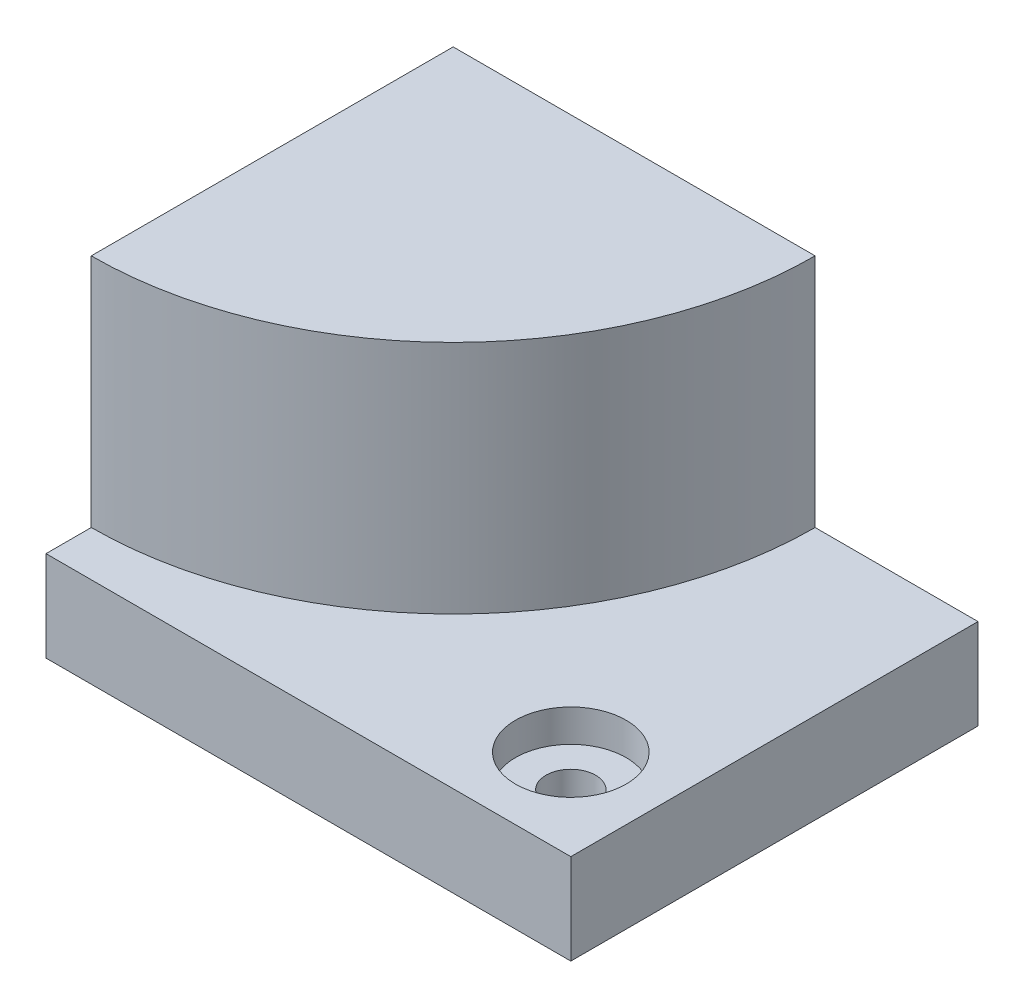
from build123d import *

# Parameters (mm, degrees)
SKETCH3_W                               = 58
SKETCH3_H                               = 45
BOSS_EXTRUDE1_DEPTH                     = 10
CBORE_FOR_M5_HEX_HEAD_BOLT1_D           = 5.5
CBORE_FOR_M5_HEX_HEAD_BOLT1_CBORE_D     = 12.24
CBORE_FOR_M5_HEX_HEAD_BOLT1_CBORE_DEPTH = 3.58
BOSS_EXTRUDE3_DEPTH                     = 16
BOSS_EXTRUDE4_DEPTH                     = 10
SKETCH10_R                              = 2
CUT_EXTRUDE2_DEPTH                      = 6


with BuildPart() as part:
    # Sketch3 → Boss-Extrude1 (new body)
    with BuildSketch(Plane(origin=(0, 0, 0), x_dir=(1, 0, 0), z_dir=(0, 1, 0))):
        Rectangle(SKETCH3_W, SKETCH3_H)
    extrude(amount=BOSS_EXTRUDE1_DEPTH)

    # CBORE for M5 Hex Head Bolt1 (through all)
    with Locations(Plane(origin=(0, 10, 0), x_dir=(1, 0, 0), z_dir=(0, 1, 0))):
        with Locations((19, -12.5)):
            CounterBoreHole(CBORE_FOR_M5_HEX_HEAD_BOLT1_D / 2, CBORE_FOR_M5_HEX_HEAD_BOLT1_CBORE_D / 2, CBORE_FOR_M5_HEX_HEAD_BOLT1_CBORE_DEPTH)

    # Sketch8 → Boss-Extrude3 (add)
    with BuildSketch(Plane(origin=(0, 10, 0), x_dir=(1, 0, 0), z_dir=(0, 1, 0))):
        with BuildLine():
            Line((11, 22.5), (1, 22.5))
            ThreePointArc((1, 22.5), (-7.786796564, 1.286796564), (-29, -7.5))
            Line((-29, -7.5), (-29, -17.5))
            ThreePointArc((-29, -17.5), (-0.715728753, -5.784271247), (11, 22.5))
        make_face()
    extrude(amount=BOSS_EXTRUDE3_DEPTH)

    # Sketch9 → Boss-Extrude4 (add)
    with BuildSketch(Plane(origin=(0, 26, 0), x_dir=(1, 0, 0), z_dir=(0, 1, 0))):
        with BuildLine():
            Line((11, 22.5), (-29, 22.5))
            Line((-29, 22.5), (-29, -17.5))
            ThreePointArc((-29, -17.5), (-0.715728753, -5.784271247), (11, 22.5))
        make_face()
    extrude(amount=BOSS_EXTRUDE4_DEPTH)

    # Sketch10 → Cut-Extrude2 (cut)
    with BuildSketch(Plane(origin=(0, 10, 0), x_dir=(1, 0, 0), z_dir=(0, 1, 0))):
        with Locations(Location((-14, 7.5, 0), (0, 0, 270))):
            Circle(SKETCH10_R)
    extrude(amount=-CUT_EXTRUDE2_DEPTH, mode=Mode.SUBTRACT)


solid = part.part
